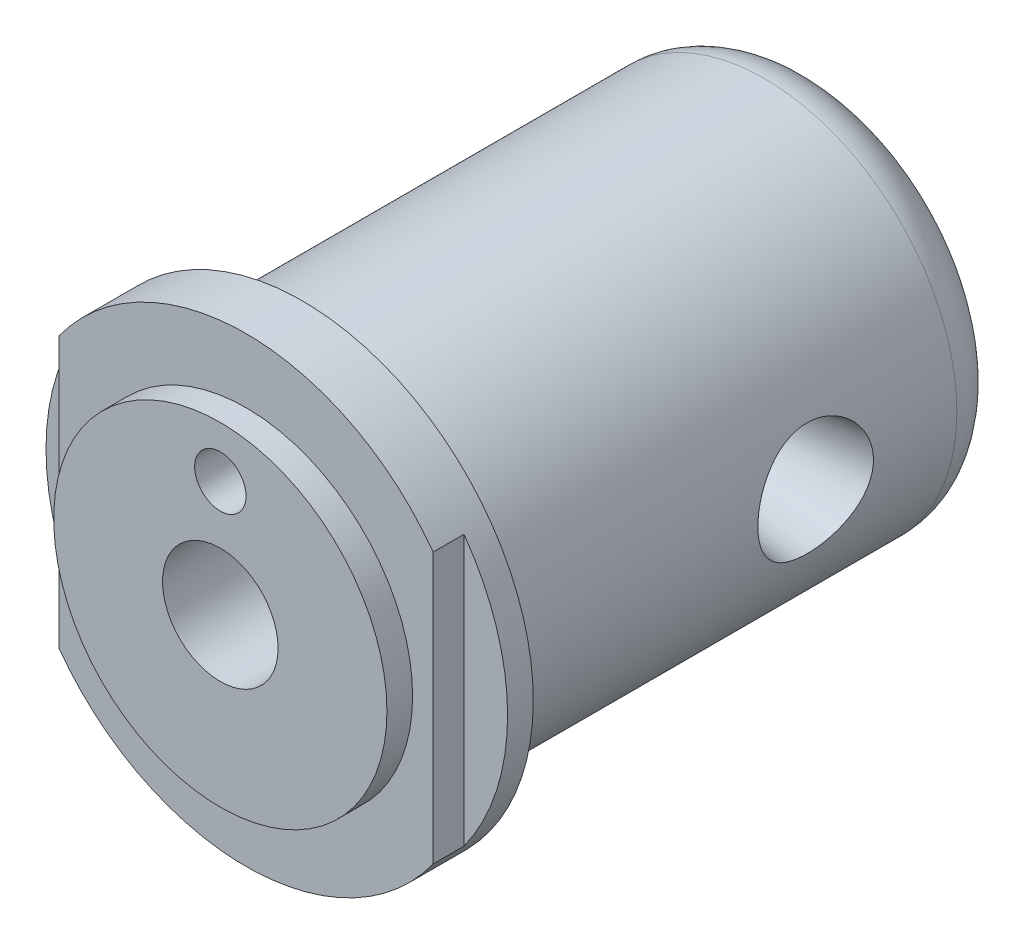
from build123d import *
from build123d.topology import SkipClean

# Parameters (mm, degrees)
SKETCH1_R                    = 6.49
BOSS_EXTRUDE1_DEPTH          = 1
BOSS_EXTRUDE2_DEPTH          = 1.2
SKETCH2_R                    = 8.99
BOSS_EXTRUDE3_DEPTH          = 1
SKETCH3_R                    = 7.49
BOSS_EXTRUDE4_DEPTH          = 20
F_7_0_7_DIAMETER_HOLE1_D     = 7
F_7_0_7_DIAMETER_HOLE1_DEPTH = 16.7
F_2_0MM_DOWEL_HOLE1_D        = 2
F_2_0MM_DOWEL_HOLE1_DEPTH    = 4
F_2_0MM_DOWEL_HOLE1_TIP      = 0.600860619
FILLET1_R                    = 2
F_4_5_4_5_DIAMETER_HOLE2_D   = 4.5
CUT_EXTRUDE2_REACH           = 31.073
CUT_EXTRUDE2_END_RADIUS      = 3.5
CUT_EXTRUDE2_DRAFT           = -7


with BuildPart() as part:
    # Sketch1 → Boss-Extrude1 (new body)
    with BuildSketch(Plane.XY):
        Circle(SKETCH1_R)
    extrude(amount=BOSS_EXTRUDE1_DEPTH)

    # Sketch1<3> → Boss-Extrude2 (add)
    with BuildSketch(Plane.XY):
        with BuildLine():
            ThreePointArc((-7.29, -5.260798418), (0, -8.99), (7.29, -5.260798418))
            Line((7.29, -5.260798418), (7.29, 5.260798418))
            ThreePointArc((7.29, 5.260798418), (0, 8.99), (-7.29, 5.260798418))
            Line((-7.29, 5.260798418), (-7.29, -5.260798418))
        make_face()
    extrude(amount=-BOSS_EXTRUDE2_DEPTH)

    # Sketch2 → Boss-Extrude3 (add)
    with SkipClean():  # the faces are left unmerged after this step: merging them gives an invalid solid
        with BuildSketch(Plane(origin=(0, 0, -1.2), x_dir=(-1, 0, 0), z_dir=(0, 0, -1))):
            Circle(SKETCH2_R)
        extrude(amount=BOSS_EXTRUDE3_DEPTH)

    # Sketch3 → Boss-Extrude4 (add)
    with SkipClean():  # the faces are left unmerged after this step: merging them gives an invalid solid
        with BuildSketch(Plane(origin=(0, 0, -2.2), x_dir=(-1, 0, 0), z_dir=(0, 0, -1))):
            Circle(SKETCH3_R)
        extrude(amount=BOSS_EXTRUDE4_DEPTH)

    # Ø7.0 (7) Diameter Hole1
    with Locations(Plane(origin=(0, 0, -22.2), x_dir=(-1, 0, 0), z_dir=(0, 0, -1))):
        with Locations((0, 0)):
            Hole(F_7_0_7_DIAMETER_HOLE1_D / 2, depth=F_7_0_7_DIAMETER_HOLE1_DEPTH)

    # Ø2.0mm Dowel Hole1
    with Locations(Plane.XY.offset(1)):
        with Locations((0, 4.5)):
            Hole(F_2_0MM_DOWEL_HOLE1_D / 2, depth=F_2_0MM_DOWEL_HOLE1_DEPTH)
            with Locations((0, 0, -(F_2_0MM_DOWEL_HOLE1_DEPTH + F_2_0MM_DOWEL_HOLE1_TIP / 2))):  # 118° drill point
                Cone(0, F_2_0MM_DOWEL_HOLE1_D / 2, F_2_0MM_DOWEL_HOLE1_TIP, mode=Mode.SUBTRACT)

    # Fillet1
    fillet1_edges = [part.edges().sort_by_distance(p)[0] for p in [
        (7.49, 0, -22.2),
    ]]
    fillet(fillet1_edges, radius=FILLET1_R)

    # Ø4.5 (4.5) Diameter Hole2 (through all)
    with Locations(Plane.XY.offset(1)):
        with Locations((0, 0)):
            Hole(F_4_5_4_5_DIAMETER_HOLE2_D / 2)

    # Cut-Extrude2: up to this cylinder (the profile starts outside it)
    with SkipClean():  # the faces are left unmerged after this step: merging them gives an invalid solid
        cut_extrude2_end = Plane(origin=(0, 0, -14.7), z_dir=(0, 0, -1)) * Cylinder(CUT_EXTRUDE2_END_RADIUS, 70.146, mode=Mode.PRIVATE)



with BuildPart() as cut_extrude2_long_prism_1:
    # Sketch10 → Cut-Extrude2 (the long prism of profile 1, to be tilted and cut off)
    with SkipClean():  # the faces are left unmerged after this step: merging them gives an invalid solid
        with BuildSketch(Plane(origin=(7.49, 0, 0), x_dir=(0, 0, -1), z_dir=(1, 0, 0))):
            with BuildLine():
                ThreePointArc((16.95, 0), (16.290990258, 1.590990258), (14.7, 2.25))
                ThreePointArc((14.7, 2.25), (12.45, 0), (14.7, -2.25))
                ThreePointArc((14.7, -2.25), (16.290990258, -1.590990258), (16.95, 0))
            make_face()
        extrude(amount=-CUT_EXTRUDE2_REACH)
        cut_extrude2_tool1_sides = [cut_extrude2_long_prism_1.faces().sort_by_distance(p)[0] for p in [
            (-8.0465, 2.25, -14.7),
        ]]
        draft(cut_extrude2_tool1_sides, Plane(origin=(7.49, 0, 0), x_dir=(0, 0, -1), z_dir=(1, 0, 0)), CUT_EXTRUDE2_DRAFT)  # the draft: side faces tilted about the start plane


with BuildPart() as part_1:
    with SkipClean():  # the faces are left unmerged after this step: merging them gives an invalid solid
        add(part.part)
        cut_extrude2_tool1 = cut_extrude2_long_prism_1.part - cut_extrude2_end
        add(cut_extrude2_tool1.solids().sort_by_distance((7.49, 0, -14.7))[0], mode=Mode.SUBTRACT)


solid = part_1.part
